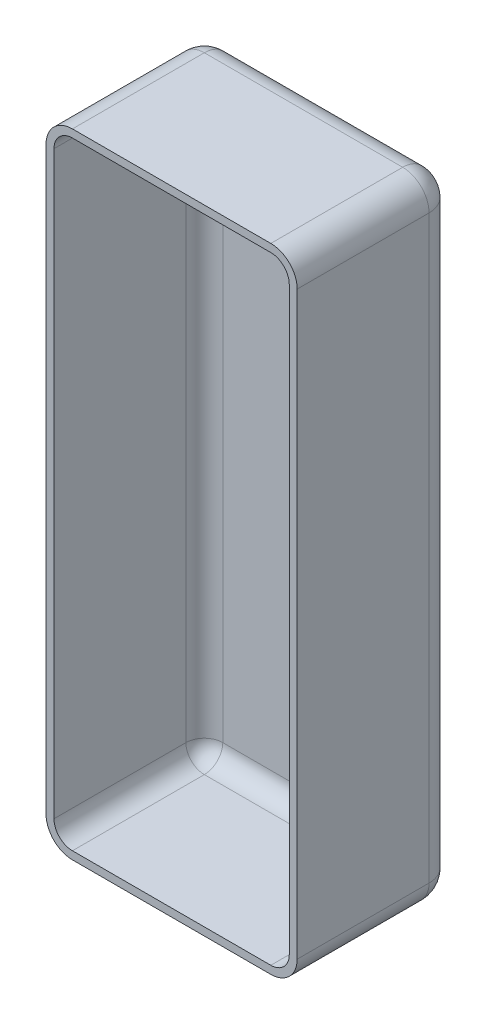
from build123d import *

# Parameters (mm, degrees)
CROQUIS1_W              = 95.2
CROQUIS1_H              = 240
SALIENTE_EXTRUIR1_DEPTH = 60
REDONDEO1_R             = 10
VACIADO1_T              = -3


with BuildPart() as part:
    # Croquis1 → Saliente-Extruir1 (new body)
    with BuildSketch(Plane.XY):
        Rectangle(CROQUIS1_W, CROQUIS1_H)
    extrude(amount=SALIENTE_EXTRUIR1_DEPTH)

    # Redondeo1
    redondeo1_edges = [part.edges().sort_by_distance(p)[0] for p in [
        (0, 120, 0),
        (47.6, 0, 0),
        (0, -120, 0),
        (-47.6, 0, 0),
        (-47.6, 120, 30),
        (47.6, 120, 30),
        (47.6, -120, 30),
        (-47.6, -120, 30),
    ]]
    fillet(redondeo1_edges, radius=REDONDEO1_R)

    # Vaciado1
    vaciado1_openings = [part.faces().sort_by_distance(p)[0] for p in [
        (0, 0, 60),
    ]]
    offset(amount=VACIADO1_T, openings=vaciado1_openings, kind=Kind.INTERSECTION)


solid = part.part
